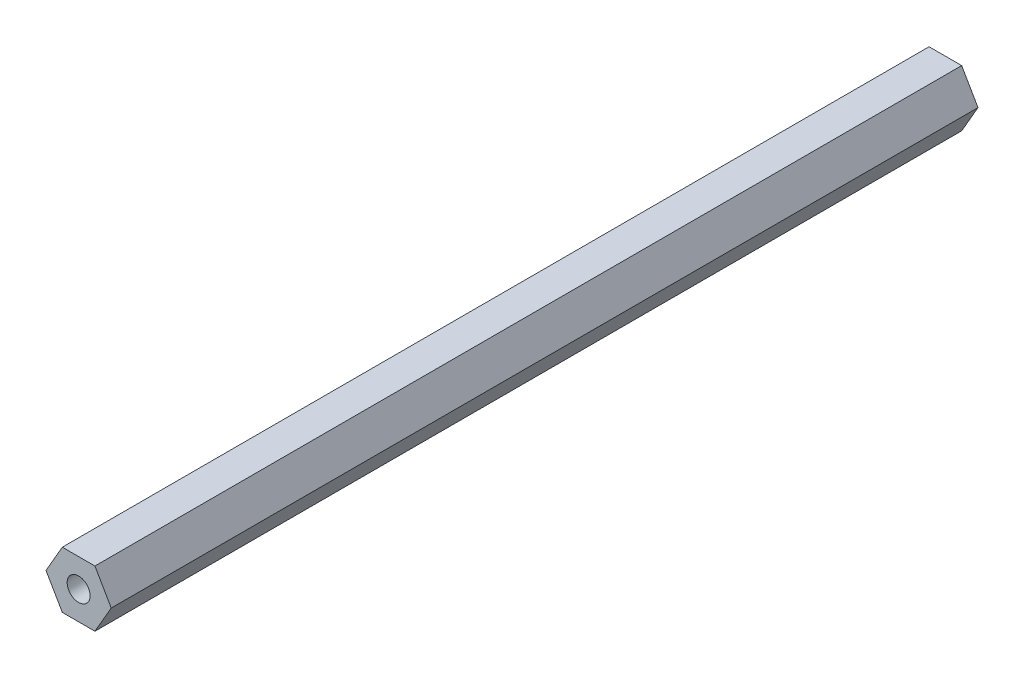
from build123d import *

# Parameters (mm, degrees)
SKETCH1_R           = 2.5796875
BOSS_EXTRUDE1_DEPTH = 194.82435


with BuildPart() as part:
    # Sketch1 → Boss-Extrude1 (new body)
    with BuildSketch(Plane.XY):
        Polygon((7.332348419, 0), (3.666174209, 6.35), (-3.666174209, 6.35), (-7.332348419, 0), (-3.666174209, -6.35), (3.666174209, -6.35), align=None)
        Circle(SKETCH1_R, mode=Mode.SUBTRACT)
    extrude(amount=BOSS_EXTRUDE1_DEPTH)


solid = part.part
